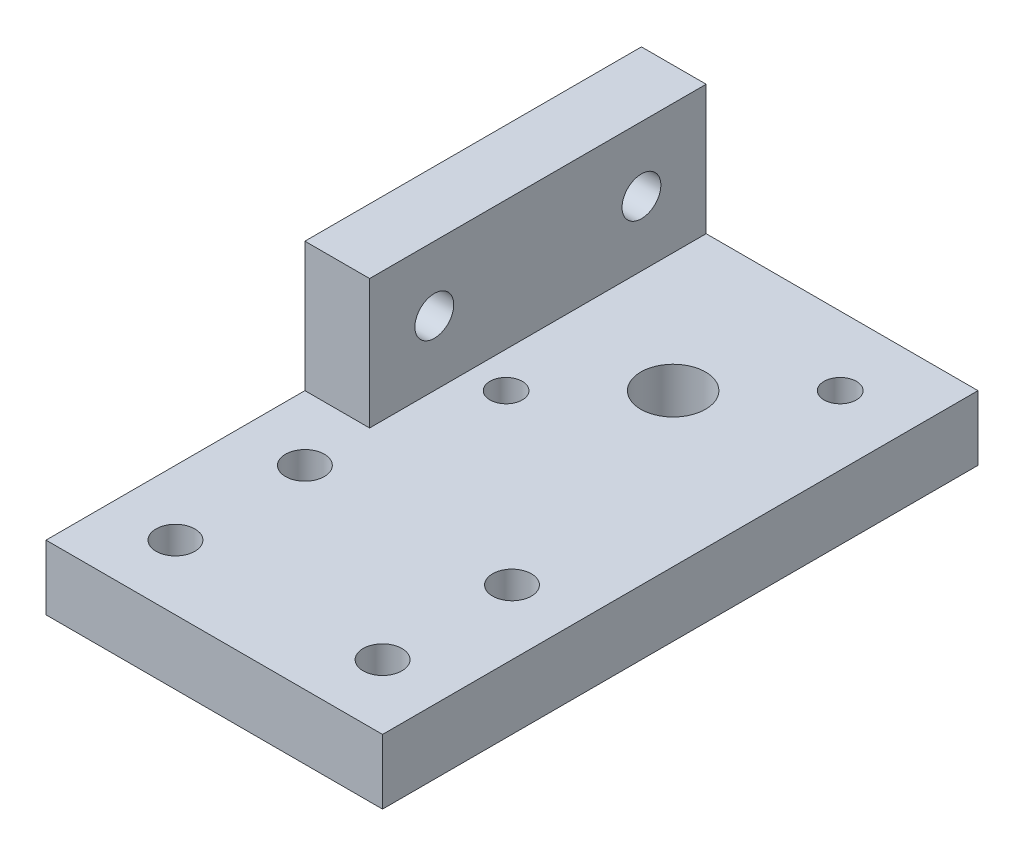
from build123d import *

# Parameters (mm, degrees)
SKETCH1_W           = 52
SKETCH1_H           = 92
BOSS_EXTRUDE1_DEPTH = 10
SKETCH2_W           = 10
SKETCH2_H           = 52
BOSS_EXTRUDE2_DEPTH = 20
CUT_EXTRUDE1_REACH  = 109.555
SKETCH3_R           = 3
SKETCH3_R_2         = 5
SKETCH3_R_3         = 2.5
CUT_EXTRUDE2_REACH  = 107.489
SKETCH4_R           = 3


with BuildPart() as part:
    # Sketch1 → Boss-Extrude1 (new body)
    with BuildSketch(Plane(origin=(0, 0, 0), x_dir=(1, 0, 0), z_dir=(0, 1, 0))):
        with Locations((26, 46)):
            Rectangle(SKETCH1_W, SKETCH1_H)
    extrude(amount=BOSS_EXTRUDE1_DEPTH)

    # Sketch2 → Boss-Extrude2 (add)
    with BuildSketch(Plane(origin=(0, 10, 0), x_dir=(1, 0, 0), z_dir=(0, 1, 0))):
        with Locations((5, 66)):
            Rectangle(SKETCH2_W, SKETCH2_H)
    extrude(amount=BOSS_EXTRUDE2_DEPTH)

    # Sketch3 → Cut-Extrude1 (cut, up to next)
    with BuildSketch(Plane(origin=(0, 10, 0), x_dir=(1, 0, 0), z_dir=(0, 1, 0)), mode=Mode.PRIVATE) as cut_extrude1_sk1:
        with Locations(Location((42, 30, 0), (0, 0, 270))):
            Circle(SKETCH3_R)
    cut_extrude1_tool1 = extrude(cut_extrude1_sk1.sketch, amount=-CUT_EXTRUDE1_REACH, mode=Mode.PRIVATE) & part.part
    # Sketch3 → Cut-Extrude1 (cut, up to next)
    with BuildSketch(Plane(origin=(0, 10, 0), x_dir=(1, 0, 0), z_dir=(0, 1, 0)), mode=Mode.PRIVATE) as cut_extrude1_sk2:
        with Locations(Location((10, 30, 0), (0, 0, 270))):
            Circle(SKETCH3_R)
    cut_extrude1_tool2 = extrude(cut_extrude1_sk2.sketch, amount=-CUT_EXTRUDE1_REACH, mode=Mode.PRIVATE) & part.part
    # Sketch3 → Cut-Extrude1 (cut, up to next)
    with BuildSketch(Plane(origin=(0, 10, 0), x_dir=(1, 0, 0), z_dir=(0, 1, 0)), mode=Mode.PRIVATE) as cut_extrude1_sk3:
        with Locations(Location((42, 10, 0), (0, 0, 270))):
            Circle(SKETCH3_R)
    cut_extrude1_tool3 = extrude(cut_extrude1_sk3.sketch, amount=-CUT_EXTRUDE1_REACH, mode=Mode.PRIVATE) & part.part
    # Sketch3 → Cut-Extrude1 (cut, up to next)
    with BuildSketch(Plane(origin=(0, 10, 0), x_dir=(1, 0, 0), z_dir=(0, 1, 0)), mode=Mode.PRIVATE) as cut_extrude1_sk4:
        with Locations(Location((10, 10, 0), (0, 0, 270))):
            Circle(SKETCH3_R)
    cut_extrude1_tool4 = extrude(cut_extrude1_sk4.sketch, amount=-CUT_EXTRUDE1_REACH, mode=Mode.PRIVATE) & part.part
    # Sketch3 → Cut-Extrude1 (cut, up to next)
    with BuildSketch(Plane(origin=(0, 10, 0), x_dir=(1, 0, 0), z_dir=(0, 1, 0)), mode=Mode.PRIVATE) as cut_extrude1_sk5:
        with Locations(Location((28.45, 68.45, 0), (0, 0, 270))):
            Circle(SKETCH3_R_2)
    cut_extrude1_tool5 = extrude(cut_extrude1_sk5.sketch, amount=-CUT_EXTRUDE1_REACH, mode=Mode.PRIVATE) & part.part
    # Sketch3 → Cut-Extrude1 (cut, up to next)
    with BuildSketch(Plane(origin=(0, 10, 0), x_dir=(1, 0, 0), z_dir=(0, 1, 0)), mode=Mode.PRIVATE) as cut_extrude1_sk6:
        with Locations(Location((41.354698757, 81.354698757, 0), (0, 0, 270))):
            Circle(SKETCH3_R_3)
    cut_extrude1_tool6 = extrude(cut_extrude1_sk6.sketch, amount=-CUT_EXTRUDE1_REACH, mode=Mode.PRIVATE) & part.part
    # Sketch3 → Cut-Extrude1 (cut, up to next)
    with BuildSketch(Plane(origin=(0, 10, 0), x_dir=(1, 0, 0), z_dir=(0, 1, 0)), mode=Mode.PRIVATE) as cut_extrude1_sk7:
        with Locations(Location((15.545301243, 55.545301243, 0), (0, 0, 270))):
            Circle(SKETCH3_R_3)
    cut_extrude1_tool7 = extrude(cut_extrude1_sk7.sketch, amount=-CUT_EXTRUDE1_REACH, mode=Mode.PRIVATE) & part.part
    add(cut_extrude1_tool1.solids().sort_by_distance((42, 10, -30))[0], mode=Mode.SUBTRACT)
    add(cut_extrude1_tool2.solids().sort_by_distance((10, 10, -30))[0], mode=Mode.SUBTRACT)
    add(cut_extrude1_tool3.solids().sort_by_distance((42, 10, -10))[0], mode=Mode.SUBTRACT)
    add(cut_extrude1_tool4.solids().sort_by_distance((10, 10, -10))[0], mode=Mode.SUBTRACT)
    add(cut_extrude1_tool5.solids().sort_by_distance((28.45, 10, -68.45))[0], mode=Mode.SUBTRACT)
    add(cut_extrude1_tool6.solids().sort_by_distance((41.354699, 10, -81.354699))[0], mode=Mode.SUBTRACT)
    add(cut_extrude1_tool7.solids().sort_by_distance((15.545301, 10, -55.545301))[0], mode=Mode.SUBTRACT)

    # Sketch4 → Cut-Extrude2 (cut, up to next)
    with BuildSketch(Plane(origin=(10, 0, 0), x_dir=(0, 0, -1), z_dir=(1, 0, 0)), mode=Mode.PRIVATE) as cut_extrude2_sk1:
        with Locations((50, 20.005)):
            Circle(SKETCH4_R)
    cut_extrude2_tool1 = extrude(cut_extrude2_sk1.sketch, amount=-CUT_EXTRUDE2_REACH, mode=Mode.PRIVATE) & part.part
    # Sketch4 → Cut-Extrude2 (cut, up to next)
    with BuildSketch(Plane(origin=(10, 0, 0), x_dir=(0, 0, -1), z_dir=(1, 0, 0)), mode=Mode.PRIVATE) as cut_extrude2_sk2:
        with Locations((82, 20.005)):
            Circle(SKETCH4_R)
    cut_extrude2_tool2 = extrude(cut_extrude2_sk2.sketch, amount=-CUT_EXTRUDE2_REACH, mode=Mode.PRIVATE) & part.part
    add(cut_extrude2_tool1.solids().sort_by_distance((10, 20.005, -50))[0], mode=Mode.SUBTRACT)
    add(cut_extrude2_tool2.solids().sort_by_distance((10, 20.005, -82))[0], mode=Mode.SUBTRACT)


solid = part.part
